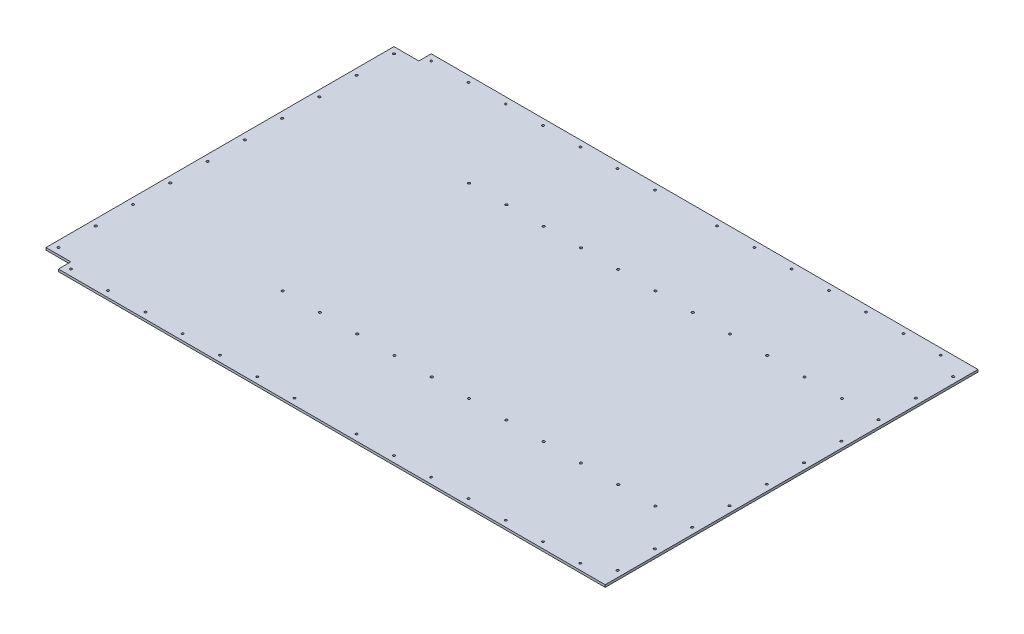
from build123d import *

# Parameters (mm, degrees)
SKETCH1_W           = 1168.4
SKETCH1_H           = 762
BOSS_EXTRUDE1_DEPTH = 4.7625
SKETCH2_W           = 50.8
SKETCH2_H           = 25.4
CUT_EXTRUDE1_DEPTH  = 698.476394874
SKETCH3_R           = 2.413
CUT_EXTRUDE2_DEPTH  = 698.476394874
SKETCH4_R           = 2.413
SKETCH4_R_2         = 2.192667861
CUT_EXTRUDE3_DEPTH  = 698.476394874


with BuildPart() as part:
    # Sketch1 → Boss-Extrude1 (new body)
    with BuildSketch(Plane(origin=(0, 0, 0), x_dir=(1, 0, 0), z_dir=(0, 1, 0))):
        Rectangle(SKETCH1_W, SKETCH1_H)
    extrude(amount=BOSS_EXTRUDE1_DEPTH)

    # Sketch2 → Cut-Extrude1 (cut, through all)
    with BuildSketch(Plane(origin=(0, 4.7625, 0), x_dir=(1, 0, 0), z_dir=(0, 1, 0))):
        with Locations((-558.8, 368.3)):
            Rectangle(SKETCH2_W, SKETCH2_H)
        with Locations((-558.8, -368.3)):
            Rectangle(SKETCH2_W, SKETCH2_H)
    extrude(amount=-CUT_EXTRUDE1_DEPTH, mode=Mode.SUBTRACT)

    # Sketch3 → Cut-Extrude2 (cut, through all)
    with BuildSketch(Plane(origin=(0, 4.7625, 0), x_dir=(1, 0, 0), z_dir=(0, 1, 0))):
        with Locations(Location((-265.524513551, -190.5, 0), (0, 0, 270))):
            Circle(SKETCH3_R)
        with Locations(Location((-189.324513551, -190.5, 0), (0, 0, 270))):
            Circle(SKETCH3_R)
        with Locations(Location((-113.124513551, -190.5, 0), (0, 0, 270))):
            Circle(SKETCH3_R)
        with Locations(Location((-36.924513551, -190.5, 0), (0, 0, 270))):
            Circle(SKETCH3_R)
        with Locations(Location((39.275486449, -190.5, 0), (0, 0, 270))):
            Circle(SKETCH3_R)
        with Locations(Location((115.475486449, -190.5, 0), (0, 0, 270))):
            Circle(SKETCH3_R)
        with Locations(Location((191.675486449, -190.5, 0), (0, 0, 270))):
            Circle(SKETCH3_R)
        with Locations(Location((267.875486449, -190.5, 0), (0, 0, 270))):
            Circle(SKETCH3_R)
        with Locations(Location((344.075486449, -190.5, 0), (0, 0, 270))):
            Circle(SKETCH3_R)
        with Locations(Location((420.275486449, -190.5, 0), (0, 0, 270))):
            Circle(SKETCH3_R)
        with Locations(Location((496.475486449, -190.5, 0), (0, 0, 270))):
            Circle(SKETCH3_R)
        with Locations(Location((496.475486449, 190.5, 0), (0, 0, 270))):
            Circle(SKETCH3_R)
        with Locations(Location((420.275486449, 190.5, 0), (0, 0, 270))):
            Circle(SKETCH3_R)
        with Locations(Location((344.075486449, 190.5, 0), (0, 0, 270))):
            Circle(SKETCH3_R)
        with Locations(Location((267.875486449, 190.5, 0), (0, 0, 270))):
            Circle(SKETCH3_R)
        with Locations(Location((191.675486449, 190.5, 0), (0, 0, 270))):
            Circle(SKETCH3_R)
        with Locations(Location((115.475486449, 190.5, 0), (0, 0, 270))):
            Circle(SKETCH3_R)
        with Locations(Location((39.275486449, 190.5, 0), (0, 0, 270))):
            Circle(SKETCH3_R)
        with Locations(Location((-36.924513551, 190.5, 0), (0, 0, 270))):
            Circle(SKETCH3_R)
        with Locations(Location((-113.124513551, 190.5, 0), (0, 0, 270))):
            Circle(SKETCH3_R)
        with Locations(Location((-189.324513551, 190.5, 0), (0, 0, 270))):
            Circle(SKETCH3_R)
        with Locations(Location((-265.524513551, 190.5, 0), (0, 0, 270))):
            Circle(SKETCH3_R)
    extrude(amount=-CUT_EXTRUDE2_DEPTH, mode=Mode.SUBTRACT)

    # Sketch4 → Cut-Extrude3 (cut, through all)
    with BuildSketch(Plane(origin=(0, 4.7625, 0), x_dir=(1, 0, 0), z_dir=(0, 1, 0))):
        with Locations(Location((-571.5, 342.9, 0), (0, 0, 270))):
            Circle(SKETCH4_R)
        with Locations(Location((-571.5, 266.7, 0), (0, 0, 270))):
            Circle(SKETCH4_R)
        with Locations(Location((-571.5, 190.5, 0), (0, 0, 270))):
            Circle(SKETCH4_R)
        with Locations(Location((-571.5, 114.3, 0), (0, 0, 270))):
            Circle(SKETCH4_R)
        with Locations(Location((-571.5, 38.1, 0), (0, 0, 270))):
            Circle(SKETCH4_R)
        with Locations(Location((-571.5, -38.1, 0), (0, 0, 270))):
            Circle(SKETCH4_R)
        with Locations(Location((-571.5, -114.3, 0), (0, 0, 270))):
            Circle(SKETCH4_R)
        with Locations(Location((-571.5, -190.5, 0), (0, 0, 270))):
            Circle(SKETCH4_R)
        with Locations(Location((-571.5, -266.7, 0), (0, 0, 270))):
            Circle(SKETCH4_R)
        with Locations(Location((-571.5, -342.9, 0), (0, 0, 270))):
            Circle(SKETCH4_R)
        with Locations(Location((-520.7, 368.3, 0), (0, 0, 270))):
            Circle(SKETCH4_R_2)
        with Locations(Location((-444.5, 368.3, 0), (0, 0, 270))):
            Circle(SKETCH4_R_2)
        with Locations(Location((-368.3, 368.3, 0), (0, 0, 270))):
            Circle(SKETCH4_R_2)
        with Locations(Location((-292.1, 368.3, 0), (0, 0, 270))):
            Circle(SKETCH4_R_2)
        with Locations(Location((-215.9, 368.3, 0), (0, 0, 270))):
            Circle(SKETCH4_R_2)
        with Locations(Location((-139.7, 368.3, 0), (0, 0, 270))):
            Circle(SKETCH4_R_2)
        with Locations(Location((-63.5, 368.3, 0), (0, 0, 270))):
            Circle(SKETCH4_R_2)
        with Locations(Location((-63.5, -368.3, 0), (0, 0, 270))):
            Circle(SKETCH4_R_2)
        with Locations(Location((-139.7, -368.3, 0), (0, 0, 270))):
            Circle(SKETCH4_R_2)
        with Locations(Location((-215.9, -368.3, 0), (0, 0, 270))):
            Circle(SKETCH4_R_2)
        with Locations(Location((-292.1, -368.3, 0), (0, 0, 270))):
            Circle(SKETCH4_R_2)
        with Locations(Location((-368.3, -368.3, 0), (0, 0, 270))):
            Circle(SKETCH4_R_2)
        with Locations(Location((-444.5, -368.3, 0), (0, 0, 270))):
            Circle(SKETCH4_R_2)
        with Locations(Location((-520.7, -368.3, 0), (0, 0, 270))):
            Circle(SKETCH4_R_2)
        with Locations(Location((520.7, -368.3, 0), (0, 0, 270))):
            Circle(SKETCH4_R_2)
        with Locations(Location((444.5, -368.3, 0), (0, 0, 270))):
            Circle(SKETCH4_R_2)
        with Locations(Location((368.3, -368.3, 0), (0, 0, 270))):
            Circle(SKETCH4_R_2)
        with Locations(Location((292.1, -368.3, 0), (0, 0, 270))):
            Circle(SKETCH4_R_2)
        with Locations(Location((215.9, -368.3, 0), (0, 0, 270))):
            Circle(SKETCH4_R_2)
        with Locations(Location((139.7, -368.3, 0), (0, 0, 270))):
            Circle(SKETCH4_R_2)
        with Locations(Location((63.5, -368.3, 0), (0, 0, 270))):
            Circle(SKETCH4_R_2)
        with Locations(Location((63.5, 368.3, 0), (0, 0, 270))):
            Circle(SKETCH4_R_2)
        with Locations(Location((139.7, 368.3, 0), (0, 0, 270))):
            Circle(SKETCH4_R_2)
        with Locations(Location((215.9, 368.3, 0), (0, 0, 270))):
            Circle(SKETCH4_R_2)
        with Locations(Location((292.1, 368.3, 0), (0, 0, 270))):
            Circle(SKETCH4_R_2)
        with Locations(Location((368.3, 368.3, 0), (0, 0, 270))):
            Circle(SKETCH4_R_2)
        with Locations(Location((444.5, 368.3, 0), (0, 0, 270))):
            Circle(SKETCH4_R_2)
        with Locations(Location((520.7, 368.3, 0), (0, 0, 270))):
            Circle(SKETCH4_R_2)
        with Locations(Location((571.5, -342.9, 0), (0, 0, 270))):
            Circle(SKETCH4_R)
        with Locations(Location((571.5, -266.7, 0), (0, 0, 270))):
            Circle(SKETCH4_R)
        with Locations(Location((571.5, -190.5, 0), (0, 0, 270))):
            Circle(SKETCH4_R)
        with Locations(Location((571.5, -114.3, 0), (0, 0, 270))):
            Circle(SKETCH4_R)
        with Locations(Location((571.5, -38.1, 0), (0, 0, 270))):
            Circle(SKETCH4_R)
        with Locations(Location((571.5, 38.1, 0), (0, 0, 270))):
            Circle(SKETCH4_R)
        with Locations(Location((571.5, 114.3, 0), (0, 0, 270))):
            Circle(SKETCH4_R)
        with Locations(Location((571.5, 190.5, 0), (0, 0, 270))):
            Circle(SKETCH4_R)
        with Locations(Location((571.5, 266.7, 0), (0, 0, 270))):
            Circle(SKETCH4_R)
        with Locations(Location((571.5, 342.9, 0), (0, 0, 270))):
            Circle(SKETCH4_R)
    extrude(amount=-CUT_EXTRUDE3_DEPTH, mode=Mode.SUBTRACT)


solid = part.part
